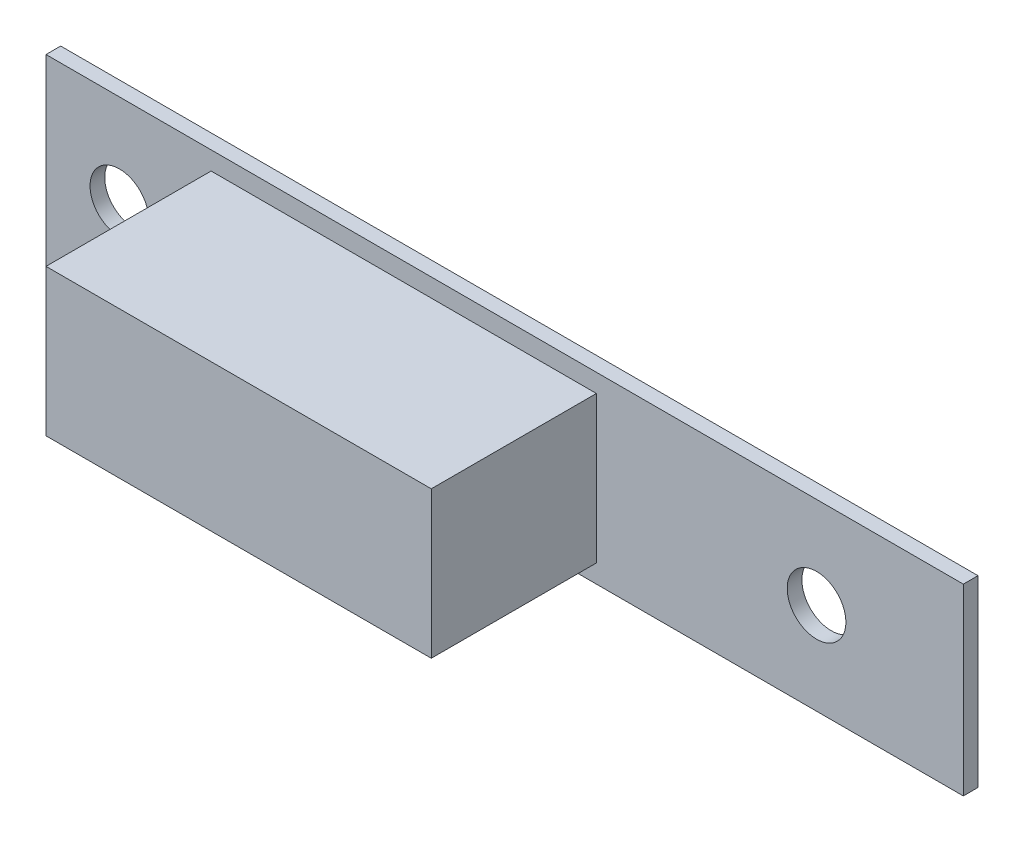
from build123d import *

# Parameters (mm, degrees)
SKETCH1_W           = 50
SKETCH1_H           = 10
SKETCH1_R           = 1.6
BOSS_EXTRUDE1_DEPTH = 0.8
SKETCH2_W           = 21
SKETCH2_H           = 8
BOSS_EXTRUDE2_DEPTH = 9


with BuildPart() as part:
    # Sketch1 → Boss-Extrude1 (new body)
    with BuildSketch(Plane.XY):
        with Locations((25, 5)):
            Rectangle(SKETCH1_W, SKETCH1_H)
        with Locations((4, 5)):
            Circle(SKETCH1_R, mode=Mode.SUBTRACT)
        with Locations((42, 5)):
            Circle(SKETCH1_R, mode=Mode.SUBTRACT)
    extrude(amount=BOSS_EXTRUDE1_DEPTH)

    # Sketch2 → Boss-Extrude2 (add)
    with BuildSketch(Plane.XY.offset(0.8)):
        with Locations((19.5, 5)):
            Rectangle(SKETCH2_W, SKETCH2_H)
    extrude(amount=BOSS_EXTRUDE2_DEPTH)


solid = part.part
